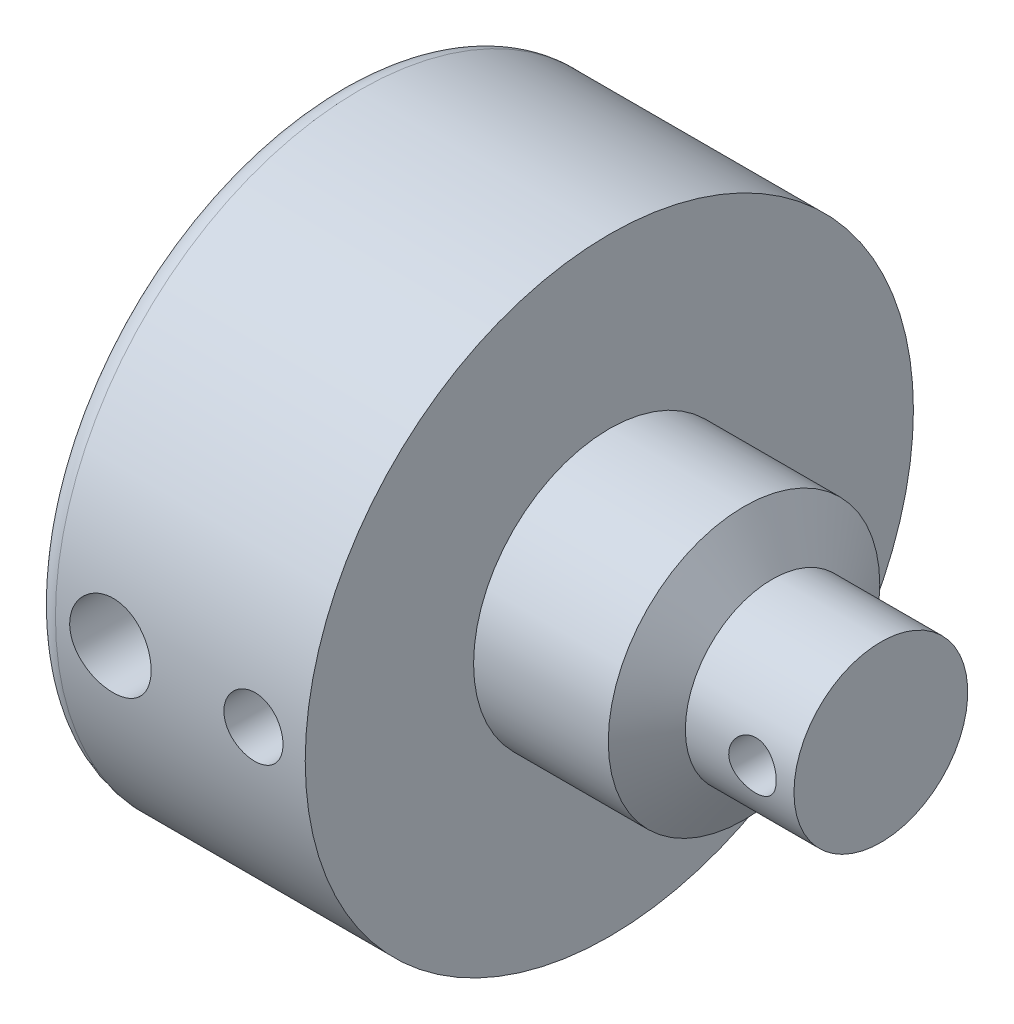
from build123d import *

# Parameters (mm, degrees)
F_29_0_136_DIAMETER_HOLE1_D     = 3.4544
F_7_64_0_10938_DIAMETER_HOLE1_D = 2.778252
F_3_16_0_1875_DIAMETER_HOLE1_D  = 4.7625
FILLET1_R                       = 1.27


with BuildPart() as part:
    # Sketch1 → Revolve1 (revolve)
    with BuildSketch(Plane.XY):
        Polygon((0, 0), (0, 17.78), (15.875, 17.78), (15.875, 7.9375), (23.750221606, 7.9375), (25.4, 5.08), (31.75, 5.08), (31.75, 0), (9.963821138, 0), align=None)
    revolve(axis=Axis((-88.99, 0, 0), (1, 0, 0)))

    # #29 (0.136) Diameter Hole1 (through all)
    with Locations(Plane(origin=(12.84650937, 0.170730154, 17.779180274), x_dir=(0, 0.999953896174, -0.009602370845), z_dir=(0, 0.009602370845, 0.999953896174))):
        with Locations((0, 0)):
            Hole(F_29_0_136_DIAMETER_HOLE1_D / 2)

    # 7/64 (0.10938) Diameter Hole1 (through all)
    with Locations(Plane(origin=(29.324260763, 0.062415003, 5.079616557), x_dir=(0, 0.99992451912, -0.012286417829), z_dir=(0, 0.012286417829, 0.99992451912))):
        with Locations((0, 0)):
            Hole(F_7_64_0_10938_DIAMETER_HOLE1_D / 2)

    # 3/16 (0.1875) Diameter Hole1 (through all)
    with Locations(Plane(origin=(4.483845062, 0.076447724, 17.77983565), x_dir=(0, 0.999990756475, -0.004299647026), z_dir=(0, 0.004299647026, 0.999990756475))):
        with Locations((0, 0)):
            Hole(F_3_16_0_1875_DIAMETER_HOLE1_D / 2)

    # Fillet1
    fillet1_edges = [part.edges().sort_by_distance(p)[0] for p in [
        (0, -17.78, 0),
    ]]
    fillet(fillet1_edges, radius=FILLET1_R)


solid = part.part
